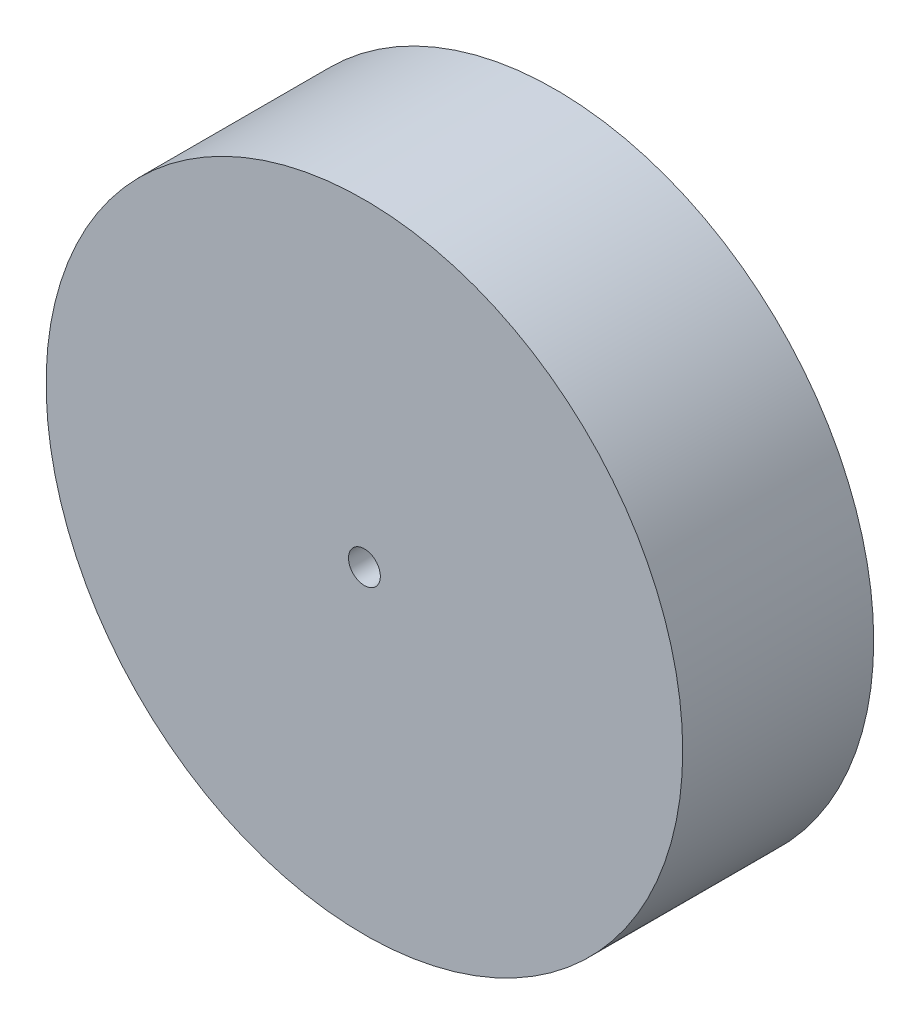
from build123d import *

# Parameters (mm, degrees)
SKETCH1_R           = 50
BOSS_EXTRUDE1_DEPTH = 30
SKETCH2_R           = 2.5
CUT_EXTRUDE1_DEPTH  = 77.811457479
SHELL1_T            = -10


with BuildPart() as part:
    # Sketch1 → Boss-Extrude1 (new body)
    with BuildSketch(Plane.XY):
        Circle(SKETCH1_R)
    extrude(amount=BOSS_EXTRUDE1_DEPTH)

    # Sketch2 → Cut-Extrude1 (cut, through all)
    with BuildSketch(Plane(origin=(0, 0, 0), x_dir=(-1, 0, 0), z_dir=(0, 0, -1))):
        Circle(SKETCH2_R)
    extrude(amount=-CUT_EXTRUDE1_DEPTH, mode=Mode.SUBTRACT)

    # Shell1
    shell1_openings = [part.faces().sort_by_distance(p)[0] for p in [
        (-48.585786438, 0, 0),
    ]]
    offset(amount=SHELL1_T, openings=shell1_openings, kind=Kind.INTERSECTION)


solid = part.part
